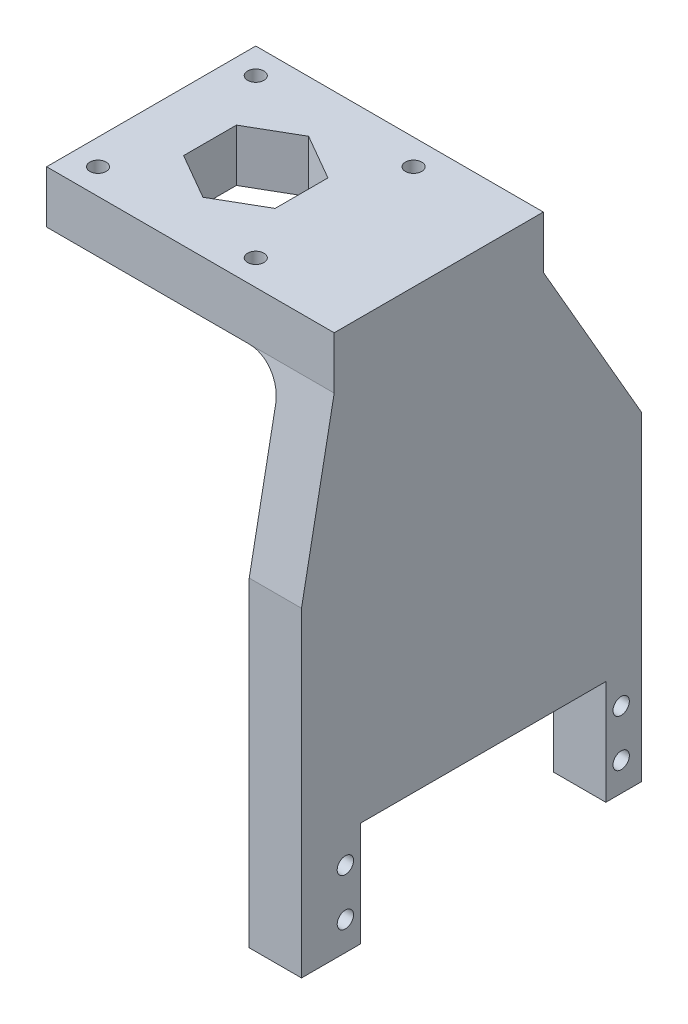
from build123d import *

# Parameters (mm, degrees)
BOSS_EXTRUDE1_DEPTH = 31
CUT_EXTRUDE1_REACH  = 97.635
SKETCH2_R           = 1.25
CUT_EXTRUDE2_REACH  = 90.781
SKETCH3_W           = 37.5
SKETCH3_H           = 16
CUT_EXTRUDE3_REACH  = 90.781
SKETCH4_R           = 1.25
CUT_EXTRUDE4_REACH  = 90.781
SKETCH6_W           = 36
SKETCH6_H           = 15
CUT_EXTRUDE5_REACH  = 90.781
FILLET1_R           = 5


with BuildPart() as part:
    # Sketch1 → Boss-Extrude1 (new, symmetric)
    with BuildSketch(Plane.XY):
        Polygon((-36, 0), (0, 0), (0, -75), (8, -75), (8, 8), (-36, 8), align=None)
    extrude(amount=BOSS_EXTRUDE1_DEPTH, both=True)

    # Sketch2 → Cut-Extrude1 (cut, up to next)
    with BuildSketch(Plane(origin=(0, 8, 0), x_dir=(1, 0, 0), z_dir=(0, 1, 0)), mode=Mode.PRIVATE) as cut_extrude1_sk1:
        with Locations(Location((-32.070312755, -12.070312755, 0), (0, 0, 180))):
            Circle(SKETCH2_R)
    cut_extrude1_tool1 = extrude(cut_extrude1_sk1.sketch, amount=-CUT_EXTRUDE1_REACH, mode=Mode.PRIVATE) & part.part
    # Sketch2 → Cut-Extrude1 (cut, up to next)
    with BuildSketch(Plane(origin=(0, 8, 0), x_dir=(1, 0, 0), z_dir=(0, 1, 0)), mode=Mode.PRIVATE) as cut_extrude1_sk2:
        with Locations(Location((-32.070312755, 12.070312755, 0), (0, 0, 180))):
            Circle(SKETCH2_R)
    cut_extrude1_tool2 = extrude(cut_extrude1_sk2.sketch, amount=-CUT_EXTRUDE1_REACH, mode=Mode.PRIVATE) & part.part
    # Sketch2 → Cut-Extrude1 (cut, up to next)
    with BuildSketch(Plane(origin=(0, 8, 0), x_dir=(1, 0, 0), z_dir=(0, 1, 0)), mode=Mode.PRIVATE) as cut_extrude1_sk3:
        with Locations(Location((-7.929687245, 12.070312755, 0), (0, 0, 180))):
            Circle(SKETCH2_R)
    cut_extrude1_tool3 = extrude(cut_extrude1_sk3.sketch, amount=-CUT_EXTRUDE1_REACH, mode=Mode.PRIVATE) & part.part
    # Sketch2 → Cut-Extrude1 (cut, up to next)
    with BuildSketch(Plane(origin=(0, 8, 0), x_dir=(1, 0, 0), z_dir=(0, 1, 0)), mode=Mode.PRIVATE) as cut_extrude1_sk4:
        with Locations(Location((-7.929687245, -12.070312755, 0), (0, 0, 180))):
            Circle(SKETCH2_R)
    cut_extrude1_tool4 = extrude(cut_extrude1_sk4.sketch, amount=-CUT_EXTRUDE1_REACH, mode=Mode.PRIVATE) & part.part
    # Sketch2 → Cut-Extrude1 (cut, up to next)
    with BuildSketch(Plane(origin=(0, 8, 0), x_dir=(1, 0, 0), z_dir=(0, 1, 0)), mode=Mode.PRIVATE) as cut_extrude1_sk5:
        Polygon((-13, 4.041451884), (-20, 8.082903769), (-27, 4.041451884), (-27, -4.041451884), (-20, -8.082903769), (-13, -4.041451884), align=None)
    cut_extrude1_tool5 = extrude(cut_extrude1_sk5.sketch, amount=-CUT_EXTRUDE1_REACH, mode=Mode.PRIVATE) & part.part
    add(cut_extrude1_tool1.solids().sort_by_distance((-32.070313, 8, 12.070313))[0], mode=Mode.SUBTRACT)
    add(cut_extrude1_tool2.solids().sort_by_distance((-32.070313, 8, -12.070313))[0], mode=Mode.SUBTRACT)
    add(cut_extrude1_tool3.solids().sort_by_distance((-7.929687, 8, -12.070313))[0], mode=Mode.SUBTRACT)
    add(cut_extrude1_tool4.solids().sort_by_distance((-7.929687, 8, 12.070313))[0], mode=Mode.SUBTRACT)
    add(cut_extrude1_tool5.solids().sort_by_distance((-20, 8, 0))[0], mode=Mode.SUBTRACT)

    # Sketch3 → Cut-Extrude2 (cut, up to next)
    with BuildSketch(Plane.ZY, mode=Mode.PRIVATE) as cut_extrude2_sk1:
        with Locations((-6.81, -67)):
            Rectangle(SKETCH3_W, SKETCH3_H)
    cut_extrude2_tool1 = extrude(cut_extrude2_sk1.sketch, amount=-CUT_EXTRUDE2_REACH, mode=Mode.PRIVATE) & part.part
    add(cut_extrude2_tool1.solids().sort_by_distance((0, -67, -6.81))[0], mode=Mode.SUBTRACT)

    # Sketch4 → Cut-Extrude3 (cut, up to next)
    with BuildSketch(Plane.ZY, mode=Mode.PRIVATE) as cut_extrude3_sk1:
        with Locations(Location((14.29, -70.6, 0), (0, 0, 270))):
            Circle(SKETCH4_R)
    cut_extrude3_tool1 = extrude(cut_extrude3_sk1.sketch, amount=-CUT_EXTRUDE3_REACH, mode=Mode.PRIVATE) & part.part
    # Sketch4 → Cut-Extrude3 (cut, up to next)
    with BuildSketch(Plane.ZY, mode=Mode.PRIVATE) as cut_extrude3_sk2:
        with Locations(Location((14.29, -63.4, 0), (0, 0, 270))):
            Circle(SKETCH4_R)
    cut_extrude3_tool2 = extrude(cut_extrude3_sk2.sketch, amount=-CUT_EXTRUDE3_REACH, mode=Mode.PRIVATE) & part.part
    # Sketch4 → Cut-Extrude3 (cut, up to next)
    with BuildSketch(Plane.ZY, mode=Mode.PRIVATE) as cut_extrude3_sk3:
        with Locations(Location((-27.91, -63.4, 0), (0, 0, 270))):
            Circle(SKETCH4_R)
    cut_extrude3_tool3 = extrude(cut_extrude3_sk3.sketch, amount=-CUT_EXTRUDE3_REACH, mode=Mode.PRIVATE) & part.part
    # Sketch4 → Cut-Extrude3 (cut, up to next)
    with BuildSketch(Plane.ZY, mode=Mode.PRIVATE) as cut_extrude3_sk4:
        with Locations(Location((-27.91, -70.6, 0), (0, 0, 270))):
            Circle(SKETCH4_R)
    cut_extrude3_tool4 = extrude(cut_extrude3_sk4.sketch, amount=-CUT_EXTRUDE3_REACH, mode=Mode.PRIVATE) & part.part
    add(cut_extrude3_tool1.solids().sort_by_distance((0, -70.6, 14.29))[0], mode=Mode.SUBTRACT)
    add(cut_extrude3_tool2.solids().sort_by_distance((0, -63.4, 14.29))[0], mode=Mode.SUBTRACT)
    add(cut_extrude3_tool3.solids().sort_by_distance((0, -63.4, -27.91))[0], mode=Mode.SUBTRACT)
    add(cut_extrude3_tool4.solids().sort_by_distance((0, -70.6, -27.91))[0], mode=Mode.SUBTRACT)

    # Sketch6 → Cut-Extrude4 (cut, up to next)
    with BuildSketch(Plane.XZ, mode=Mode.PRIVATE) as cut_extrude4_sk1:
        with Locations((-18, -23.5)):
            Rectangle(SKETCH6_W, SKETCH6_H)
    cut_extrude4_tool1 = extrude(cut_extrude4_sk1.sketch, amount=-CUT_EXTRUDE4_REACH, mode=Mode.PRIVATE) & part.part
    # Sketch6 → Cut-Extrude4 (cut, up to next)
    with BuildSketch(Plane.XZ, mode=Mode.PRIVATE) as cut_extrude4_sk2:
        with Locations((-18, 23.5)):
            Rectangle(SKETCH6_W, SKETCH6_H)
    cut_extrude4_tool2 = extrude(cut_extrude4_sk2.sketch, amount=-CUT_EXTRUDE4_REACH, mode=Mode.PRIVATE) & part.part
    add(cut_extrude4_tool1.solids().sort_by_distance((-18, 0, -23.5))[0], mode=Mode.SUBTRACT)
    add(cut_extrude4_tool2.solids().sort_by_distance((-18, 0, 23.5))[0], mode=Mode.SUBTRACT)

    # Sketch7 → Cut-Extrude5 (cut, up to next)
    with BuildSketch(Plane.ZY, mode=Mode.PRIVATE) as cut_extrude5_sk1:
        Polygon((-16, 0), (-31, -26), (-31, 8), (-16, 8), align=None)
    cut_extrude5_tool1 = extrude(cut_extrude5_sk1.sketch, amount=-CUT_EXTRUDE5_REACH, mode=Mode.PRIVATE) & part.part
    # Sketch7 → Cut-Extrude5 (cut, up to next)
    with BuildSketch(Plane.ZY, mode=Mode.PRIVATE) as cut_extrude5_sk2:
        Polygon((16, 0), (21, -26), (21, -75), (31, -75), (31, 8), (16, 8), align=None)
    cut_extrude5_tool2 = extrude(cut_extrude5_sk2.sketch, amount=-CUT_EXTRUDE5_REACH, mode=Mode.PRIVATE) & part.part
    add(cut_extrude5_tool1.solids().sort_by_distance((0, -3.84127, -25.047619))[0], mode=Mode.SUBTRACT)
    add(cut_extrude5_tool2.solids().sort_by_distance((0, -30.16934, 25.215686))[0], mode=Mode.SUBTRACT)

    # Fillet1
    fillet1_edges = [part.edges().sort_by_distance(p)[0] for p in [
        (0, 0, 0),
    ]]
    fillet(fillet1_edges, radius=FILLET1_R)


solid = part.part
